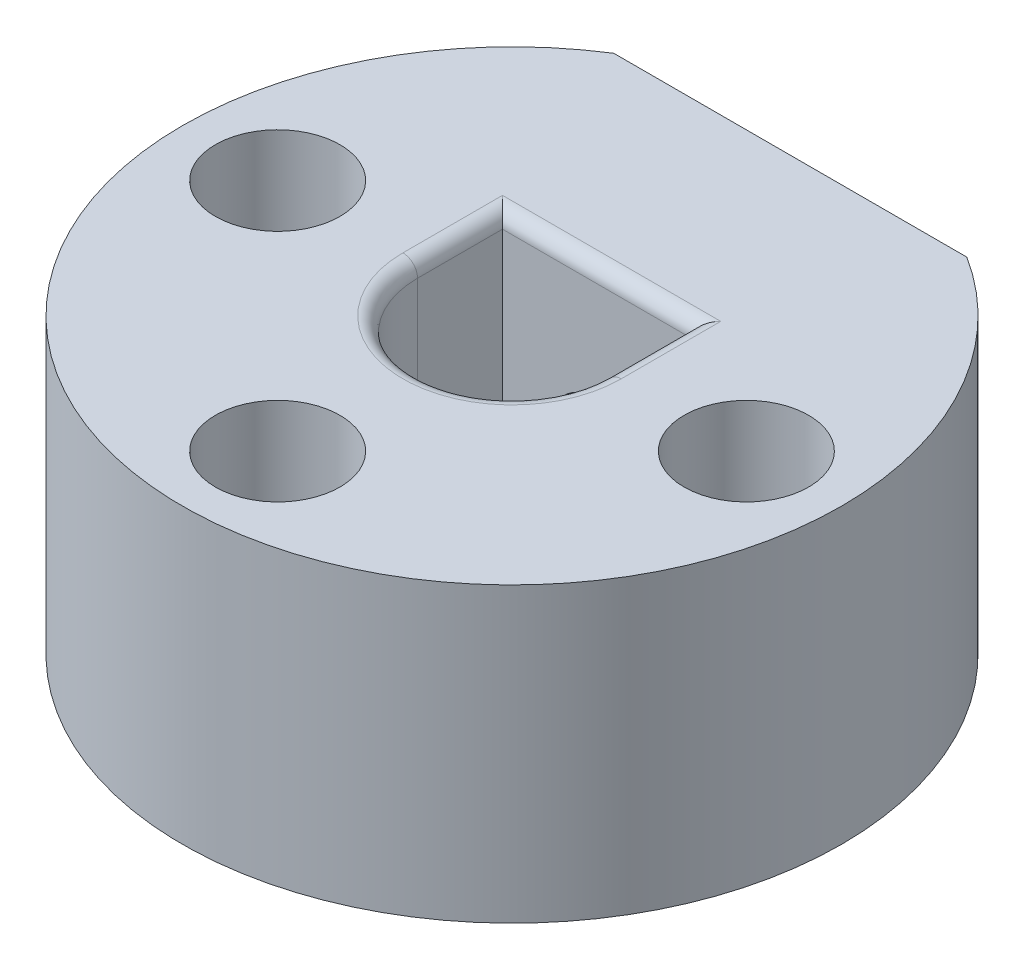
from build123d import *

# Parameters (mm, degrees)
BOSS_EXTRU_1_DEPTH             = 10
CBORE_FOR_M2_SHCS1_D           = 2.5
CBORE_FOR_M2_SHCS1_CBORE_D     = 4.25
CBORE_FOR_M2_SHCS1_CBORE_DEPTH = 8.5
CONG_1_R                       = 0.5
ESQUISSE6_R                    = 1.6
ENL_V_MAT_EXTRU_1_DEPTH        = 19.791620526
ESQUISSE7_W                    = 5.85
ESQUISSE7_H                    = 2.25
ENL_V_MAT_EXTRU_2_DEPTH        = 7.25
SKETCH1_R                      = 4.5
CUT_EXTRUDE1_DEPTH             = 3


with BuildPart() as part:
    # Esquisse1 → Boss.-Extru.1 (new body)
    with BuildSketch(Plane(origin=(0, 0, 0), x_dir=(1, 0, 0), z_dir=(0, 1, 0))):
        with BuildLine():
            Line((6.025985397, 9.5), (-6.025985397, 9.5))
            ThreePointArc((-6.025985397, 9.5), (0, -11.25), (6.025985397, 9.5))
        make_face()
        with BuildLine():
            Line((-3.225, 0), (-3.225, 2.9))
            Line((-3.225, 2.9), (3.225, 2.9))
            Line((3.225, 2.9), (3.225, 0))
            ThreePointArc((3.225, 0), (0, -3.225), (-3.225, 0))
        make_face(mode=Mode.SUBTRACT)
    extrude(amount=BOSS_EXTRU_1_DEPTH)

    # CBORE for M2 SHCS1 (through all)
    with Locations(Plane(origin=(0, 10, 0), x_dir=(1, 0, 0), z_dir=(0, 1, 0))):
        with Locations((8, 0), (-8, 0), (0, 0), (0, -8)):
            CounterBoreHole(CBORE_FOR_M2_SHCS1_D / 2, CBORE_FOR_M2_SHCS1_CBORE_D / 2, CBORE_FOR_M2_SHCS1_CBORE_DEPTH)

    # Congé1
    cong_1_edges = [part.edges().sort_by_distance(p)[0] for p in [
        (0, 10, 3.225),
        (3.225, 10, -1.45),
        (0, 10, -2.9),
        (-3.225, 10, -1.45),
    ]]
    fillet(cong_1_edges, radius=CONG_1_R)

    # Esquisse6 → Enlèv. mat.-Extru.1 (cut, through all)
    with BuildSketch(Plane.XY):
        with Locations((0, 4.5)):
            Circle(ESQUISSE6_R)
    extrude(amount=-ENL_V_MAT_EXTRU_1_DEPTH, mode=Mode.SUBTRACT)

    # Esquisse7 → Enlèv. mat.-Extru.2 (cut)
    with BuildSketch(Plane(origin=(0, 0, 0), x_dir=(1, 0, 0), z_dir=(0, 1, 0))):
        with Locations((0, 5.525)):
            Rectangle(ESQUISSE7_W, ESQUISSE7_H)
    extrude(amount=ENL_V_MAT_EXTRU_2_DEPTH, mode=Mode.SUBTRACT)

    # Sketch1 → Cut-Extrude1 (cut)
    with BuildSketch(Plane.XZ):
        Circle(SKETCH1_R)
    extrude(amount=-CUT_EXTRUDE1_DEPTH, mode=Mode.SUBTRACT)


solid = part.part
